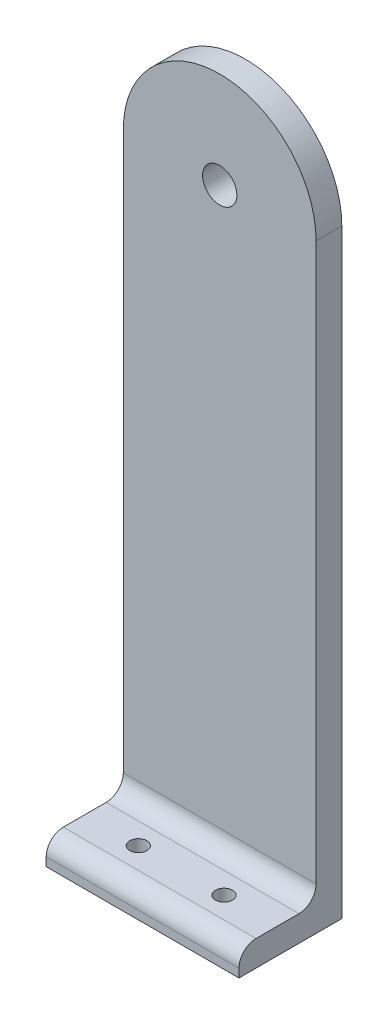
from build123d import *

# Parameters (mm, degrees)
BOSS_EXTRUDE1_DEPTH = 7.62
BOSS_EXTRUDE2_DEPTH = 57.15
FILLET1_R           = 5.08
SKETCH3_R           = 2.54
CUT_EXTRUDE1_DEPTH  = 204.09877166
SKETCH4_R           = 5.08
CUT_EXTRUDE2_DEPTH  = 183.642823634


with BuildPart() as part:
    # Sketch1 → Boss-Extrude1 (new body)
    with BuildSketch(Plane.XY):
        with BuildLine():
            Line((-28.575, 0), (-28.575, -177.8))
            Line((-28.575, -177.8), (28.575, -177.8))
            Line((28.575, -177.8), (28.575, 0))
            ThreePointArc((28.575, 0), (0, 28.575), (-28.575, 0))
        make_face()
    extrude(amount=BOSS_EXTRUDE1_DEPTH)

    # Sketch2 → Boss-Extrude2 (add, through all)
    with BuildSketch(Plane.ZY.offset(28.575)):
        with BuildLine():
            Line((0, -177.8), (30.48, -177.8))
            Line((30.48, -177.8), (30.48, -175.26))
            ThreePointArc((30.48, -175.26), (28.992102448, -171.667897552), (25.4, -170.18))
            Line((25.4, -170.18), (0, -170.18))
            Line((0, -170.18), (0, -177.8))
        make_face()
    extrude(amount=-BOSS_EXTRUDE2_DEPTH)

    # Fillet1
    fillet1_edges = [part.edges().sort_by_distance(p)[0] for p in [
        (0, -170.18, 7.62),
    ]]
    fillet(fillet1_edges, radius=FILLET1_R)

    # Sketch3 → Cut-Extrude1 (cut, through all)
    with BuildSketch(Plane(origin=(0, -170.18, 0), x_dir=(1, 0, 0), z_dir=(0, 1, 0))):
        with Locations(Location((12.7, -19.05, 0), (0, 0, 180))):
            Circle(SKETCH3_R)
        with Locations(Location((-12.7, -19.05, 0), (0, 0, 180))):
            Circle(SKETCH3_R)
    extrude(amount=-CUT_EXTRUDE1_DEPTH, mode=Mode.SUBTRACT)

    # Sketch4 → Cut-Extrude2 (cut, through all)
    with BuildSketch(Plane(origin=(0, 0, 0), x_dir=(-1, 0, 0), z_dir=(0, 0, -1))):
        Circle(SKETCH4_R)
    extrude(amount=-CUT_EXTRUDE2_DEPTH, mode=Mode.SUBTRACT)


solid = part.part
